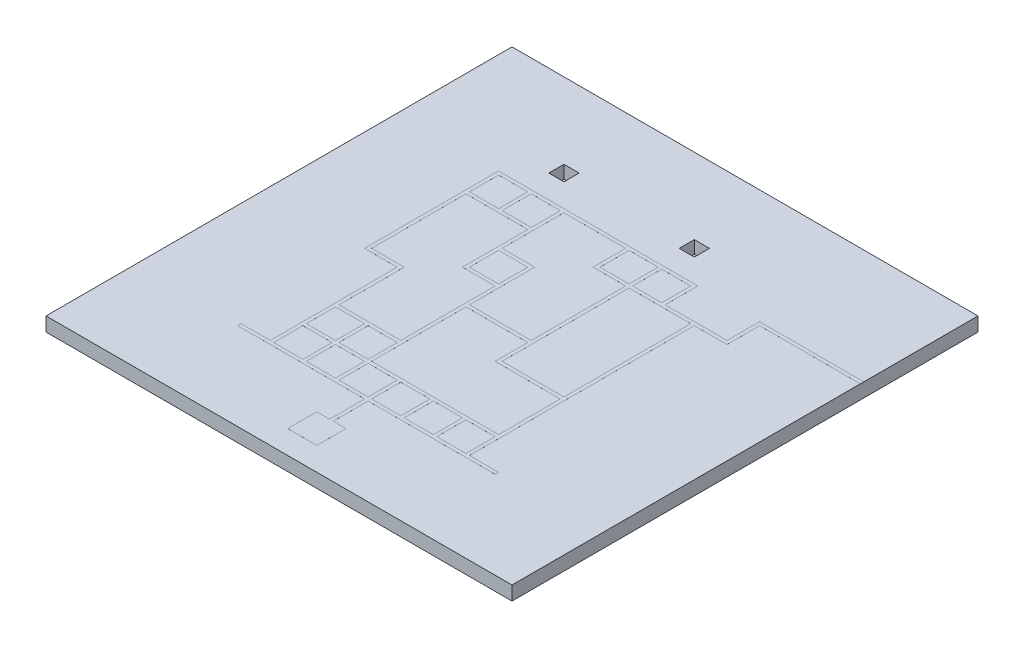
from build123d import *

# Parameters (mm, degrees)
SKETCH1_W                 = 4000
SKETCH1_H                 = 4000
BOSS_EXTRUDE1_DEPTH       = 120
START_DEPTH               = 0.1
SKETCH5_W                 = 1090
SKETCH5_H                 = 30
FIRST_LINE_DEPTH          = 0.1
SKETCH7_W                 = 30
SKETCH7_H                 = 250
SKETCH7_H_2               = 30
SKETCH7_W_2               = 250
FIRST_SET_OF_GRIDS_DEPTH  = 0.1
SKETCH9_W                 = 30
SKETCH9_H                 = 250
SKETCH9_H_2               = 30
SKETCH9_W_2               = 250
SECOND_SET_OF_GRIDS_DEPTH = 0.1
SKETCH10_W                = 30
SKETCH10_H                = 280
THIRD_SET_DEPTH           = 0.1
SKETCH13_W                = 30
SKETCH13_H                = 30
SKETCH13_W_2              = 250
SKETCH13_H_2              = 250
F_4TH_SET_DEPTH           = 0.1
SKETCH14_W                = 30
SKETCH14_H                = 250
SKETCH14_H_2              = 30
SKETCH14_W_2              = 250
F_5TH_SET_DEPTH           = 0.1
SKETCH15_W                = 30
SKETCH15_H                = 250
SKETCH15_H_2              = 30
F_6TH_SET_DEPTH           = 0.1
SKETCH16_W                = 30
SKETCH16_H                = 250
SKETCH16_H_2              = 30
SKETCH16_W_2              = 250
F_7TH_SET_DEPTH           = 0.1
SKETCH17_W                = 30
SKETCH17_H                = 250
SKETCH17_H_2              = 30
SKETCH17_W_2              = 250
SKETCH17_W_3              = 865
F_8TH_SET_DEPTH           = 0.1
CAVITIES_DEPTH            = 110


with BuildPart() as part:
    # Sketch1 → Boss-Extrude1 (new body)
    with BuildSketch(Plane(origin=(0, 0, 0), x_dir=(1, 0, 0), z_dir=(0, 1, 0))):
        with Locations((-1913.736021211, -1950.54740935)):
            Rectangle(SKETCH1_W, SKETCH1_H)
    extrude(amount=BOSS_EXTRUDE1_DEPTH)

    # Sketch4 → Start (add)
    with BuildSketch(Plane(origin=(0, 120, 0), x_dir=(1, 0, 0), z_dir=(0, 1, 0))):
        Polygon((-2038.736021211, -3500.54740935), (-2038.736021211, -3750.54740935), (-1913.736021211, -3750.54740935), (-1788.736021211, -3750.54740935), (-1788.736021211, -3500.54740935), align=None)
    extrude(amount=START_DEPTH)

    # Sketch5 → First line (add)
    with BuildSketch(Plane(origin=(0, 120, 0), x_dir=(1, 0, 0), z_dir=(0, 1, 0))):
        with Locations((-1353.736021211, -3185.54740935)):
            Rectangle(SKETCH5_W, SKETCH5_H)
        with Locations((-2473.736021211, -3185.54740935)):
            Rectangle(SKETCH5_W, SKETCH5_H)
        Polygon((-1928.736021211, -3500.54740935), (-1913.736021211, -3500.54740935), (-1913.736021211, -3239.780731093), (-1913.736021211, -3233.358018457), (-1913.736021211, -3200.54740935), (-1928.736021211, -3200.54740935), align=None)
        Polygon((-1913.736021211, -3239.780731093), (-1913.736021211, -3500.54740935), (-1898.736021211, -3500.54740935), (-1898.736021211, -3200.54740935), (-1913.736021211, -3200.54740935), (-1913.736021211, -3233.358018457), align=None)
        Polygon((-1898.736021211, -3170.54740935), (-1898.736021211, -3200.54740935), (-1913.736021211, -3200.54740935), (-1928.736021211, -3200.54740935), (-1928.736021211, -3170.54740935), align=None)
    extrude(amount=FIRST_LINE_DEPTH)

    # Sketch7 → First set of grids (add)
    with BuildSketch(Plane(origin=(0, 120, 0), x_dir=(1, 0, 0), z_dir=(0, 1, 0))):
        with Locations((-2753.736021211, -3045.54740935)):
            Rectangle(SKETCH7_W, SKETCH7_H)
        with Locations((-2753.736021211, -2905.54740935)):
            Rectangle(SKETCH7_W, SKETCH7_H_2)
        with Locations((-2613.736021211, -2905.54740935)):
            Rectangle(SKETCH7_W_2, SKETCH7_H_2)
        with Locations((-2473.736021211, -2905.54740935)):
            Rectangle(SKETCH7_W, SKETCH7_H_2)
        with Locations((-2473.736021211, -3045.54740935)):
            Rectangle(SKETCH7_W, SKETCH7_H)
        with Locations((-2333.736021211, -2905.54740935)):
            Rectangle(SKETCH7_W_2, SKETCH7_H_2)
        with Locations((-2193.736021211, -2905.54740935)):
            Rectangle(SKETCH7_W, SKETCH7_H_2)
        with Locations((-2193.736021211, -3045.54740935)):
            Rectangle(SKETCH7_W, SKETCH7_H)
        with Locations((-2053.736021211, -2905.54740935)):
            Rectangle(SKETCH7_W_2, SKETCH7_H_2)
        with Locations((-1913.736021211, -2905.54740935)):
            Rectangle(SKETCH7_W, SKETCH7_H_2)
        with Locations((-1773.736021211, -2905.54740935)):
            Rectangle(SKETCH7_W_2, SKETCH7_H_2)
        with Locations((-1913.736021211, -3045.54740935)):
            Rectangle(SKETCH7_W, SKETCH7_H)
        with Locations((-1493.736021211, -2905.54740935)):
            Rectangle(SKETCH7_W_2, SKETCH7_H_2)
        with Locations((-1633.736021211, -2905.54740935)):
            Rectangle(SKETCH7_W, SKETCH7_H_2)
        with Locations((-1633.736021211, -3045.54740935)):
            Rectangle(SKETCH7_W, SKETCH7_H)
        with Locations((-1353.736021211, -2905.54740935)):
            Rectangle(SKETCH7_W, SKETCH7_H_2)
        with Locations((-1353.736021211, -3045.54740935)):
            Rectangle(SKETCH7_W, SKETCH7_H)
        with Locations((-1213.736021211, -2905.54740935)):
            Rectangle(SKETCH7_W_2, SKETCH7_H_2)
        with Locations((-1073.736021211, -2905.54740935)):
            Rectangle(SKETCH7_W, SKETCH7_H_2)
        with Locations((-1073.736021211, -3045.54740935)):
            Rectangle(SKETCH7_W, SKETCH7_H)
    extrude(amount=FIRST_SET_OF_GRIDS_DEPTH)

    # Sketch9 → Second Set of grids (add)
    with BuildSketch(Plane(origin=(0, 120, 0), x_dir=(1, 0, 0), z_dir=(0, 1, 0))):
        with Locations((-2753.736021211, -2765.54740935)):
            Rectangle(SKETCH9_W, SKETCH9_H)
        with Locations((-2753.736021211, -2625.54740935)):
            Rectangle(SKETCH9_W, SKETCH9_H_2)
        with Locations((-2613.736021211, -2625.54740935)):
            Rectangle(SKETCH9_W_2, SKETCH9_H_2)
        with Locations((-2473.736021211, -2625.54740935)):
            Rectangle(SKETCH9_W, SKETCH9_H_2)
        with Locations((-2473.736021211, -2765.54740935)):
            Rectangle(SKETCH9_W, SKETCH9_H)
        with Locations((-2333.736021211, -2625.54740935)):
            Rectangle(SKETCH9_W_2, SKETCH9_H_2)
        with Locations((-2193.736021211, -2625.54740935)):
            Rectangle(SKETCH9_W, SKETCH9_H_2)
        with Locations((-2193.736021211, -2765.54740935)):
            Rectangle(SKETCH9_W, SKETCH9_H)
        with Locations((-1073.736021211, -2765.54740935)):
            Rectangle(SKETCH9_W, SKETCH9_H)
        with Locations((-1073.736021211, -2625.54740935)):
            Rectangle(SKETCH9_W, SKETCH9_H_2)
    extrude(amount=SECOND_SET_OF_GRIDS_DEPTH)

    # Sketch10 → Third Set (add)
    with BuildSketch(Plane(origin=(0, 120, 0), x_dir=(1, 0, 0), z_dir=(0, 1, 0))):
        with Locations((-2753.736021211, -2470.54740935)):
            Rectangle(SKETCH10_W, SKETCH10_H)
        with Locations((-2193.736021211, -2470.54740935)):
            Rectangle(SKETCH10_W, SKETCH10_H)
        Polygon((-1088.736021211, -2610.54740935), (-1058.736021211, -2610.54740935), (-1058.736021211, -2330.54740935), (-1648.736021211, -2330.54740935), (-1648.736021211, -2360.54740935), (-1088.736021211, -2360.54740935), align=None)
    extrude(amount=THIRD_SET_DEPTH)

    # Sketch13 → 4th set (add)
    with BuildSketch(Plane(origin=(0, 120, 0), x_dir=(1, 0, 0), z_dir=(0, 1, 0))):
        with Locations((-3033.736021211, -2065.54740935)):
            Rectangle(SKETCH13_W, SKETCH13_H)
        with Locations((-2893.736021211, -2065.54740935)):
            Rectangle(SKETCH13_W_2, SKETCH13_H)
        with Locations((-2753.736021211, -2065.54740935)):
            Rectangle(SKETCH13_W, SKETCH13_H)
        with Locations((-2753.736021211, -2205.54740935)):
            Rectangle(SKETCH13_W, SKETCH13_H_2)
        with Locations((-2193.736021211, -2205.54740935)):
            Rectangle(SKETCH13_W, SKETCH13_H_2)
        with Locations((-2193.736021211, -2065.54740935)):
            Rectangle(SKETCH13_W, SKETCH13_H)
        with Locations((-2053.736021211, -2065.54740935)):
            Rectangle(SKETCH13_W_2, SKETCH13_H)
        with Locations((-1773.736021211, -2065.54740935)):
            Rectangle(SKETCH13_W_2, SKETCH13_H)
        with Locations((-1913.736021211, -2065.54740935)):
            Rectangle(SKETCH13_W, SKETCH13_H)
        with Locations((-1633.736021211, -2065.54740935)):
            Rectangle(SKETCH13_W, SKETCH13_H)
        with Locations((-1633.736021211, -2205.54740935)):
            Rectangle(SKETCH13_W, SKETCH13_H_2)
        with Locations((-1073.736021211, -2205.54740935)):
            Rectangle(SKETCH13_W, SKETCH13_H_2)
        with Locations((-1073.736021211, -2065.54740935)):
            Rectangle(SKETCH13_W, SKETCH13_H)
    extrude(amount=F_4TH_SET_DEPTH)

    # Sketch14 → 5th set (add)
    with BuildSketch(Plane(origin=(0, 120, 0), x_dir=(1, 0, 0), z_dir=(0, 1, 0))):
        with Locations((-3033.736021211, -1925.54740935)):
            Rectangle(SKETCH14_W, SKETCH14_H)
        with Locations((-3033.736021211, -1785.54740935)):
            Rectangle(SKETCH14_W, SKETCH14_H_2)
        with Locations((-2333.736021211, -1785.54740935)):
            Rectangle(SKETCH14_W_2, SKETCH14_H_2)
        with Locations((-2473.736021211, -1785.54740935)):
            Rectangle(SKETCH14_W, SKETCH14_H_2)
        with Locations((-2193.736021211, -1785.54740935)):
            Rectangle(SKETCH14_W, SKETCH14_H_2)
        with Locations((-2193.736021211, -1925.54740935)):
            Rectangle(SKETCH14_W, SKETCH14_H)
        with Locations((-1633.736021211, -1925.54740935)):
            Rectangle(SKETCH14_W, SKETCH14_H)
        with Locations((-1633.736021211, -1785.54740935)):
            Rectangle(SKETCH14_W, SKETCH14_H_2)
        with Locations((-1073.736021211, -1925.54740935)):
            Rectangle(SKETCH14_W, SKETCH14_H)
        with Locations((-1073.736021211, -1785.54740935)):
            Rectangle(SKETCH14_W, SKETCH14_H_2)
    extrude(amount=F_5TH_SET_DEPTH)

    # Sketch15 → 6th set (add)
    with BuildSketch(Plane(origin=(0, 120, 0), x_dir=(1, 0, 0), z_dir=(0, 1, 0))):
        with Locations((-3033.736021211, -1645.54740935)):
            Rectangle(SKETCH15_W, SKETCH15_H)
        with Locations((-3033.736021211, -1505.54740935)):
            Rectangle(SKETCH15_W, SKETCH15_H_2)
        with Locations((-2473.736021211, -1645.54740935)):
            Rectangle(SKETCH15_W, SKETCH15_H)
        Polygon((-2458.736021211, -1520.54740935), (-2488.736021211, -1520.54740935), (-2488.736021211, -1490.54740935), (-2458.736021211, -1490.54740935), (-2208.736021211, -1490.54740935), (-2208.736021211, -1520.54740935), align=None)
        Polygon((-2208.736021211, -1520.54740935), (-2208.736021211, -1770.54740935), (-2178.736021211, -1770.54740935), (-2178.736021211, -1520.54740935), (-2178.736021211, -1490.54740935), (-2208.736021211, -1490.54740935), align=None)
        with Locations((-1633.736021211, -1645.54740935)):
            Rectangle(SKETCH15_W, SKETCH15_H)
        with Locations((-1073.736021211, -1645.54740935)):
            Rectangle(SKETCH15_W, SKETCH15_H)
        with Locations((-1073.736021211, -1505.54740935)):
            Rectangle(SKETCH15_W, SKETCH15_H_2)
        with Locations((-1633.736021211, -1505.54740935)):
            Rectangle(SKETCH15_W, SKETCH15_H_2)
    extrude(amount=F_6TH_SET_DEPTH)

    # Sketch16 → 7th set (add)
    with BuildSketch(Plane(origin=(0, 120, 0), x_dir=(1, 0, 0), z_dir=(0, 1, 0))):
        with Locations((-3033.736021211, -1365.54740935)):
            Rectangle(SKETCH16_W, SKETCH16_H)
        with Locations((-3033.736021211, -1225.54740935)):
            Rectangle(SKETCH16_W, SKETCH16_H_2)
        with Locations((-2893.736021211, -1225.54740935)):
            Rectangle(SKETCH16_W_2, SKETCH16_H_2)
        with Locations((-2753.736021211, -1225.54740935)):
            Rectangle(SKETCH16_W, SKETCH16_H_2)
        with Locations((-2613.736021211, -1225.54740935)):
            Rectangle(SKETCH16_W_2, SKETCH16_H_2)
        with Locations((-2473.736021211, -1365.54740935)):
            Rectangle(SKETCH16_W, SKETCH16_H)
        with Locations((-2473.736021211, -1225.54740935)):
            Rectangle(SKETCH16_W, SKETCH16_H_2)
        with Locations((-1633.736021211, -1365.54740935)):
            Rectangle(SKETCH16_W, SKETCH16_H)
        with Locations((-1773.736021211, -1225.54740935)):
            Rectangle(SKETCH16_W_2, SKETCH16_H_2)
        with Locations((-1913.736021211, -1225.54740935)):
            Rectangle(SKETCH16_W, SKETCH16_H_2)
        with Locations((-1633.736021211, -1225.54740935)):
            Rectangle(SKETCH16_W, SKETCH16_H_2)
        with Locations((-1493.736021211, -1225.54740935)):
            Rectangle(SKETCH16_W_2, SKETCH16_H_2)
        with Locations((-1353.736021211, -1225.54740935)):
            Rectangle(SKETCH16_W, SKETCH16_H_2)
        with Locations((-1213.736021211, -1225.54740935)):
            Rectangle(SKETCH16_W_2, SKETCH16_H_2)
        with Locations((-933.736021211, -1225.54740935)):
            Rectangle(SKETCH16_W_2, SKETCH16_H_2)
        with Locations((-793.736021211, -1225.54740935)):
            Rectangle(SKETCH16_W, SKETCH16_H_2)
        with Locations((-1073.736021211, -1225.54740935)):
            Rectangle(SKETCH16_W, SKETCH16_H_2)
        with Locations((-1073.736021211, -1365.54740935)):
            Rectangle(SKETCH16_W, SKETCH16_H)
    extrude(amount=F_7TH_SET_DEPTH)

    # Sketch17 → 8th set (add)
    with BuildSketch(Plane(origin=(0, 120, 0), x_dir=(1, 0, 0), z_dir=(0, 1, 0))):
        with Locations((-3033.736021211, -1085.54740935)):
            Rectangle(SKETCH17_W, SKETCH17_H)
        with Locations((-3033.736021211, -945.54740935)):
            Rectangle(SKETCH17_W, SKETCH17_H_2)
        with Locations((-2893.736021211, -945.54740935)):
            Rectangle(SKETCH17_W_2, SKETCH17_H_2)
        with Locations((-2753.736021211, -945.54740935)):
            Rectangle(SKETCH17_W, SKETCH17_H_2)
        with Locations((-2613.736021211, -945.54740935)):
            Rectangle(SKETCH17_W_2, SKETCH17_H_2)
        with Locations((-2753.736021211, -1085.54740935)):
            Rectangle(SKETCH17_W, SKETCH17_H)
        Polygon((-2488.736021211, -960.54740935), (-2488.736021211, -1210.54740935), (-2458.736021211, -1210.54740935), (-2458.736021211, -960.54740935), (-2458.736021211, -930.54740935), (-2488.736021211, -930.54740935), align=None)
        with Locations((-2333.736021211, -945.54740935)):
            Rectangle(SKETCH17_W_2, SKETCH17_H_2)
        with Locations((-2193.736021211, -945.54740935)):
            Rectangle(SKETCH17_W, SKETCH17_H_2)
        with Locations((-2053.736021211, -945.54740935)):
            Rectangle(SKETCH17_W_2, SKETCH17_H_2)
        Polygon((-1928.736021211, -930.54740935), (-1928.736021211, -960.54740935), (-1928.736021211, -1210.54740935), (-1898.736021211, -1210.54740935), (-1898.736021211, -960.54740935), (-1898.736021211, -930.54740935), align=None)
        with Locations((-1773.736021211, -945.54740935)):
            Rectangle(SKETCH17_W_2, SKETCH17_H_2)
        with Locations((-1633.736021211, -945.54740935)):
            Rectangle(SKETCH17_W, SKETCH17_H_2)
        with Locations((-1633.736021211, -1085.54740935)):
            Rectangle(SKETCH17_W, SKETCH17_H)
        with Locations((-1493.736021211, -945.54740935)):
            Rectangle(SKETCH17_W_2, SKETCH17_H_2)
        with Locations((-1353.736021211, -945.54740935)):
            Rectangle(SKETCH17_W, SKETCH17_H_2)
        with Locations((-1353.736021211, -1085.54740935)):
            Rectangle(SKETCH17_W, SKETCH17_H)
        with Locations((-793.736021211, -1085.54740935)):
            Rectangle(SKETCH17_W, SKETCH17_H)
        with Locations((-793.736021211, -945.54740935)):
            Rectangle(SKETCH17_W, SKETCH17_H_2)
        with Locations((-346.236021211, -945.54740935)):
            Rectangle(SKETCH17_W_3, SKETCH17_H_2)
    extrude(amount=F_8TH_SET_DEPTH)

    # Sketch18 → Cavities (cut)
    with BuildSketch(Plane(origin=(0, 120, 0), x_dir=(1, 0, 0), z_dir=(0, 1, 0))):
        Polygon((-2817.799107354, -730.54740935), (-2767.799107354, -730.54740935), (-2752.799107354, -730.54740935), (-2737.799107354, -730.54740935), (-2687.799107354, -730.54740935), (-2687.799107354, -600.54740935), (-2817.799107354, -600.54740935), align=None)
        Polygon((-1698.736021211, -730.54740935), (-1648.736021211, -730.54740935), (-1633.736021211, -730.54740935), (-1618.736021211, -730.54740935), (-1568.736021211, -730.54740935), (-1568.736021211, -600.54740935), (-1698.736021211, -600.54740935), align=None)
    extrude(amount=-CAVITIES_DEPTH, mode=Mode.SUBTRACT)


solid = part.part
